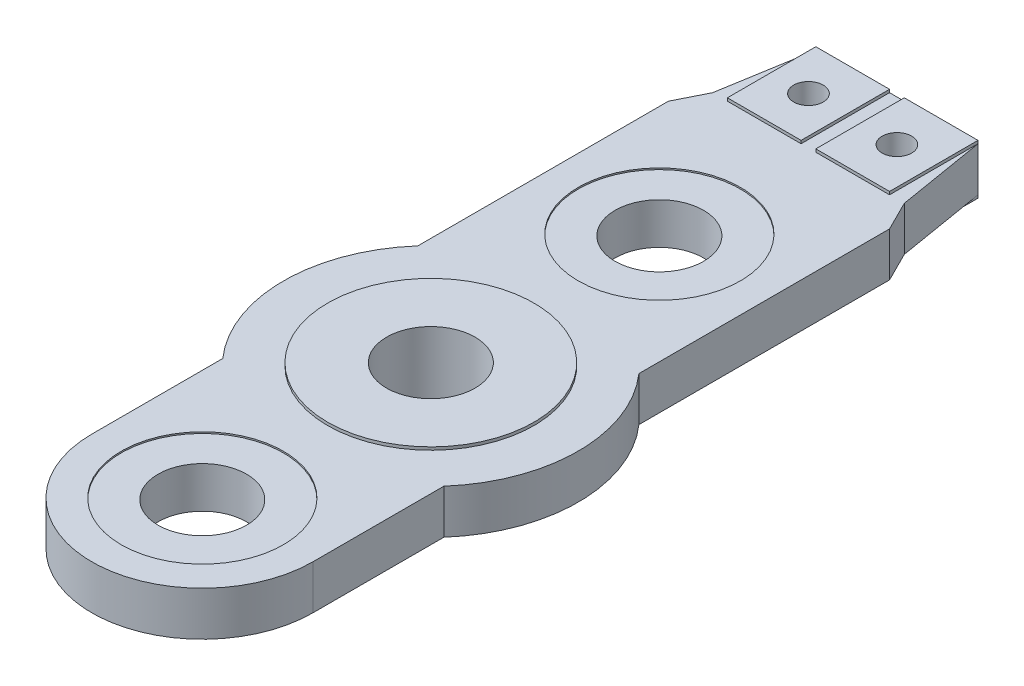
from build123d import *

# Parameters (mm, degrees)
SKETCH1_R           = 1.5
SKETCH1_R_2         = 0.5
BOSS_EXTRUDE1_DEPTH = 1.5
SKETCH2_R           = 3.5
SKETCH2_R_2         = 1.5
BOSS_EXTRUDE2_DEPTH = 0.1
SKETCH3_R           = 2.75
CUT_EXTRUDE1_DEPTH  = 0.05
CUT_EXTRUDE2_START  = -0.05
SKETCH4_R           = 2.75
CUT_EXTRUDE2_DEPTH  = 0.05
BOSS_EXTRUDE3_START = 1.5
SKETCH5_R           = 2.75
SKETCH5_R_2         = 1.5
BOSS_EXTRUDE3_DEPTH = 1.5
FILLET1_R           = 0.5
SKETCH6_W           = 2.5
SKETCH6_H           = 3
SKETCH6_R           = 0.5
BOSS_EXTRUDE4_DEPTH = 0.1
BOSS_EXTRUDE5_START = 0.1
SKETCH7_W           = 2.5
SKETCH7_H           = 3
SKETCH7_R           = 0.5
BOSS_EXTRUDE5_DEPTH = 0.1


with BuildPart() as part:
    # Sketch1 → Boss-Extrude1 (new body)
    with BuildSketch(Plane(origin=(0, 0, 0), x_dir=(1, 0, 0), z_dir=(0, 1, 0))):
        with BuildLine():
            Line((-3.75, -7.75), (-3.75, -3.307189139))
            ThreePointArc((-3.75, -3.307189139), (-5, 0), (-3.75, 3.307189139))
            Line((-3.75, 3.307189139), (-3.75, 11.807189139))
            Line((-3.75, 11.807189139), (-3.25, 12.807189139))
            Line((-3.25, 12.807189139), (-2.75, 15.807189139))
            Line((-2.75, 15.807189139), (2.75, 15.807189139))
            Line((2.75, 15.807189139), (3.25, 12.807189139))
            Line((3.25, 12.807189139), (3.75, 11.807189139))
            Line((3.75, 11.807189139), (3.75, 3.307189139))
            ThreePointArc((3.75, 3.307189139), (5, 0), (3.75, -3.307189139))
            Line((3.75, -3.307189139), (3.75, -7.75))
            ThreePointArc((3.75, -7.75), (0, -11.5), (-3.75, -7.75))
        make_face()
        with Locations(Location((0, -7.75, 0), (0, 0, 270))):
            Circle(SKETCH1_R, mode=Mode.SUBTRACT)
        with Locations(Location((0, 7.75, 0), (0, 0, 270))):
            Circle(SKETCH1_R, mode=Mode.SUBTRACT)
        with Locations(Location((-1.5, 14.307189139, 0), (0, 0, 270))):
            Circle(SKETCH1_R_2, mode=Mode.SUBTRACT)
        with Locations(Location((1.5, 14.307189139, 0), (0, 0, 270))):
            Circle(SKETCH1_R_2, mode=Mode.SUBTRACT)
        with Locations(Location((0, 0, 0), (0, 0, 270))):
            Circle(SKETCH1_R, mode=Mode.SUBTRACT)
    extrude(amount=BOSS_EXTRUDE1_DEPTH)

    # Sketch2 → Boss-Extrude2 (add)
    with BuildSketch(Plane(origin=(0, 1.5, 0), x_dir=(1, 0, 0), z_dir=(0, 1, 0))):
        with Locations(Location((0, 0, 0), (0, 0, 270))):
            Circle(SKETCH2_R)
        with Locations(Location((0, 0, 0), (0, 0, 270))):
            Circle(SKETCH2_R_2, mode=Mode.SUBTRACT)
    extrude(amount=BOSS_EXTRUDE2_DEPTH)

    # Sketch3 → Cut-Extrude1 (cut)
    with BuildSketch(Plane(origin=(0, 1.5, 0), x_dir=(1, 0, 0), z_dir=(0, 1, 0))):
        with Locations(Location((0, -7.75, 0), (0, 0, 270))):
            Circle(SKETCH3_R)
        with Locations(Location((0, 7.75, 0), (0, 0, 270))):
            Circle(SKETCH3_R)
    extrude(amount=-CUT_EXTRUDE1_DEPTH, mode=Mode.SUBTRACT)

    # Sketch4 → Cut-Extrude2 (cut)
    with BuildSketch(Plane.XZ.offset(CUT_EXTRUDE2_START)):
        with Locations(Location((0, -7.75, 0), (0, 0, 90))):
            Circle(SKETCH4_R)
        with Locations(Location((0, 7.75, 0), (0, 0, 90))):
            Circle(SKETCH4_R)
    extrude(amount=CUT_EXTRUDE2_DEPTH, mode=Mode.SUBTRACT)

    # Sketch5 → Boss-Extrude3 (add)
    with BuildSketch(Plane.XZ.offset(BOSS_EXTRUDE3_START)):
        with Locations(Location((0, 0, 0), (0, 0, 90))):
            Circle(SKETCH5_R)
        with Locations(Location((0, 0, 0), (0, 0, 270))):
            Circle(SKETCH5_R_2, mode=Mode.SUBTRACT)
    extrude(amount=-BOSS_EXTRUDE3_DEPTH)

    # Fillet1
    fillet1_edges = [part.edges().sort_by_distance(p)[0] for p in [
        (0, 0, -2.75),
    ]]
    fillet(fillet1_edges, radius=FILLET1_R)

    # Sketch6 → Boss-Extrude4 (add)
    # profile 1 of 2: a face of its own
    with BuildSketch(Plane(origin=(0, 1.5, 0), x_dir=(1, 0, 0), z_dir=(0, 1, 0))):
        with Locations((-1.5, 14.307189139)):
            Rectangle(SKETCH6_W, SKETCH6_H)
        with Locations(Location((-1.5, 14.307189139, 0), (0, 0, 270))):
            Circle(SKETCH6_R, mode=Mode.SUBTRACT)
    # profile 2 of 2: a face of its own
    with BuildSketch(Plane(origin=(0, 1.5, 0), x_dir=(1, 0, 0), z_dir=(0, 1, 0))):
        with Locations((1.5, 14.307189139)):
            Rectangle(SKETCH6_W, SKETCH6_H)
        with Locations(Location((1.5, 14.307189139, 0), (0, 0, 270))):
            Circle(SKETCH6_R, mode=Mode.SUBTRACT)
    extrude(amount=BOSS_EXTRUDE4_DEPTH)

    # Sketch7 → Boss-Extrude5 (add)
    # profile 1 of 2: a face of its own
    with BuildSketch(Plane.XZ.offset(BOSS_EXTRUDE5_START)):
        with Locations((-1.5, -14.307189139)):
            Rectangle(SKETCH7_W, SKETCH7_H)
        with Locations(Location((-1.5, -14.307189139, 0), (0, 0, 270))):
            Circle(SKETCH7_R, mode=Mode.SUBTRACT)
    # profile 2 of 2: a face of its own
    with BuildSketch(Plane.XZ.offset(BOSS_EXTRUDE5_START)):
        with Locations((1.5, -14.307189139)):
            Rectangle(SKETCH7_W, SKETCH7_H)
        with Locations(Location((1.5, -14.307189139, 0), (0, 0, 270))):
            Circle(SKETCH7_R, mode=Mode.SUBTRACT)
    extrude(amount=-BOSS_EXTRUDE5_DEPTH)


solid = part.part
